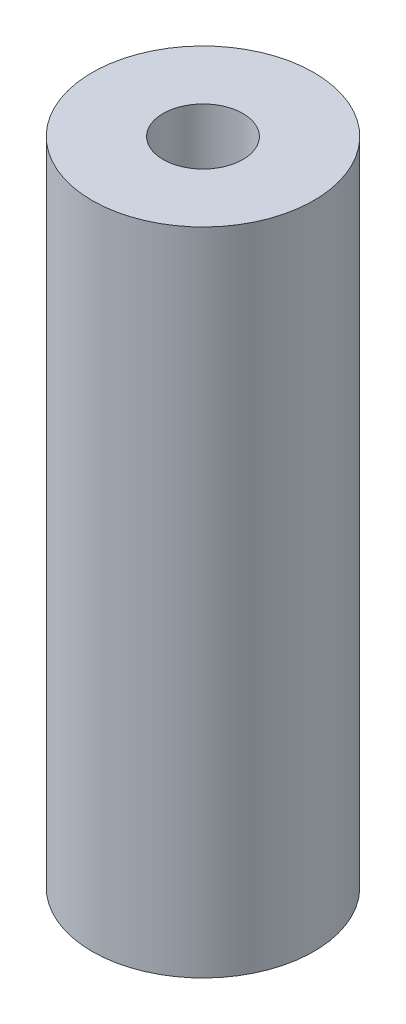
from build123d import *

# Parameters (mm, degrees)
SKETCH1_R           = 3.75
BOSS_EXTRUDE1_DEPTH = 22
SKETCH2_R           = 1.35
CUT_EXTRUDE1_DEPTH  = 23.630178965


with BuildPart() as part:
    # Sketch1 → Boss-Extrude1 (new body)
    with BuildSketch(Plane(origin=(0, 0, 0), x_dir=(1, 0, 0), z_dir=(0, 1, 0))):
        with Locations(Location((0, 0, 0), (0, 0, 270))):
            Circle(SKETCH1_R)
    extrude(amount=BOSS_EXTRUDE1_DEPTH)

    # Sketch2 → Cut-Extrude1 (cut, through all)
    with BuildSketch(Plane.XZ):
        with Locations(Location((0, 0, 0), (0, 0, 270))):
            Circle(SKETCH2_R)
    extrude(amount=-CUT_EXTRUDE1_DEPTH, mode=Mode.SUBTRACT)


solid = part.part
